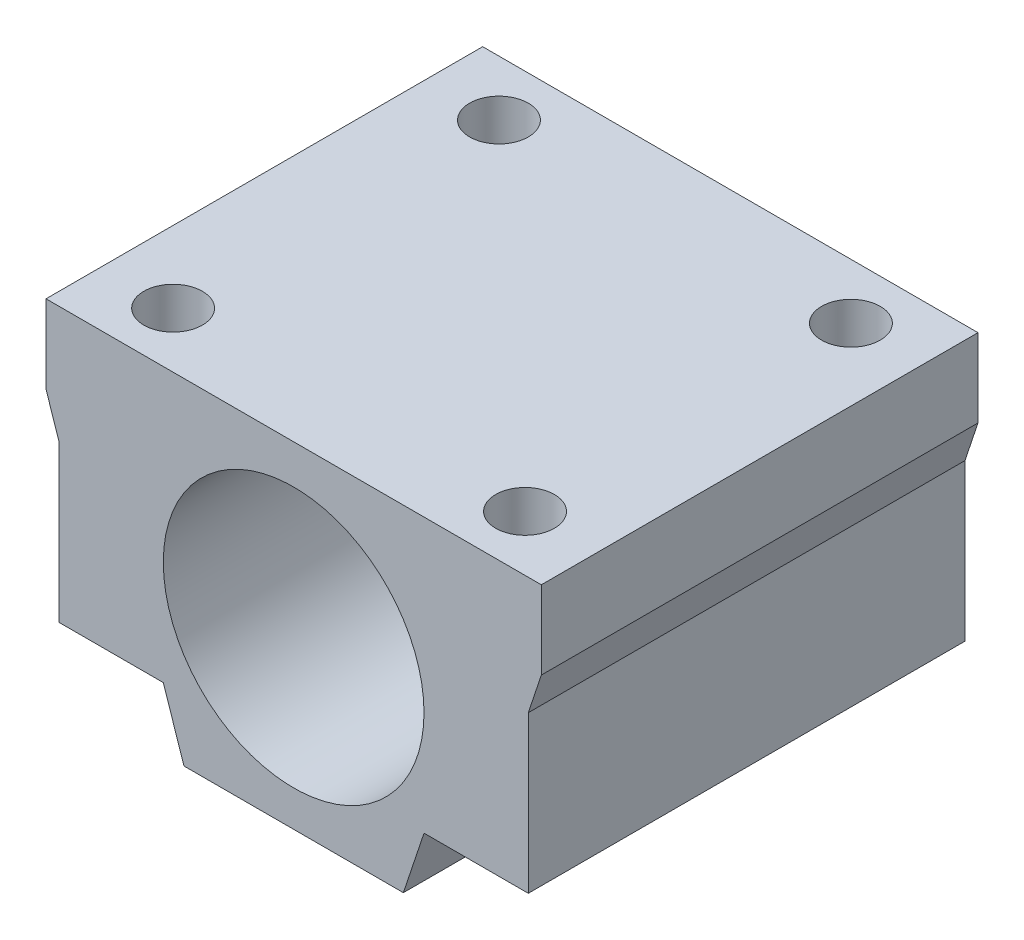
from build123d import *

# Parameters (mm, degrees)
DODANIE_WYCI_GNI_CIE1_DEPTH      = 33.5
DODANIE_WYCI_GNI_CIE1_DEPTH_BACK = 33.5
SZKIC1_R                         = 20
OTW_R_POD_RUB_M81_D              = 9
LUSTRO2_COPY_1_D                 = 9


with BuildPart() as part:
    # Szkic1 → Dodanie-wyciągnięcie1 (new, two sides: drawn at the far end of the back side and taken through both)
    with BuildSketch(Plane.XY.offset(-DODANIE_WYCI_GNI_CIE1_DEPTH_BACK)):
        Polygon((16.833333333, -25.5), (-16.833333333, -25.5), (-20, -16), (-36, -16), (-36, 8), (-38, 14), (-38, 26), (38, 26), (38, 14), (36, 8), (36, -16), (20, -16), align=None)
        Circle(SZKIC1_R, mode=Mode.SUBTRACT)
    extrude(amount=DODANIE_WYCI_GNI_CIE1_DEPTH + DODANIE_WYCI_GNI_CIE1_DEPTH_BACK)

    # Otwór pod śrubę M81 (through all)
    with Locations(Plane(origin=(0, -16, 0), x_dir=(-1, 0, 0), z_dir=(0, -1, 0))):
        with Locations((-27, -25)):
            otw_r_pod_rub_m81 = Hole(OTW_R_POD_RUB_M81_D / 2)

    # Lustro1: Otwór pod śrubę M81 across plane
    add(otw_r_pod_rub_m81.mirror(Plane(origin=(0, 0, 0), x_dir=(0, 0, 1), z_dir=(1, 0, 0))), mode=Mode.SUBTRACT)

    # Lustro2: Otwór pod śrubę M81 across plane
    add(otw_r_pod_rub_m81.mirror(Plane.XY), mode=Mode.SUBTRACT)

    # Lustro2 copy 1 (through all)
    with Locations(Plane.XZ.offset(16)):
        with Locations((-27, -25)):
            Hole(LUSTRO2_COPY_1_D / 2)


solid = part.part
